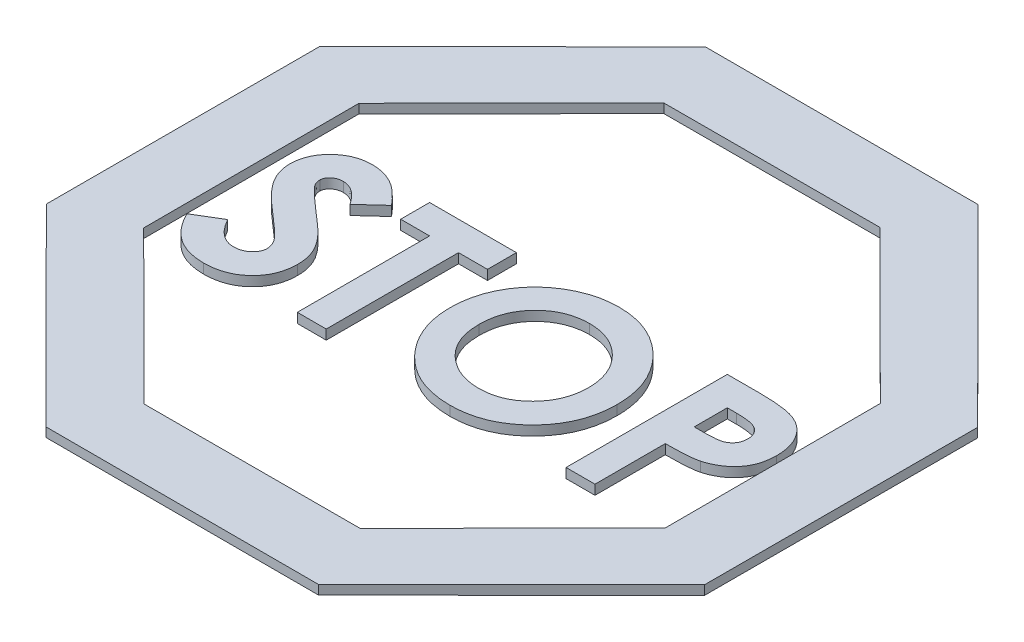
from build123d import *

# Parameters (mm, degrees)
BOSS_EXTRUDE2_DEPTH        = 2
BOSS_EXTRUDE3_DEPTH        = 0.1
BOSS_EXTRUDE3_DEPTH_BACK   = 2
BOSS_EXTRUDE3_2_DEPTH      = 0.1
BOSS_EXTRUDE3_2_DEPTH_BACK = 2
BOSS_EXTRUDE3_3_DEPTH      = 0.1
BOSS_EXTRUDE3_3_DEPTH_BACK = 2
BOSS_EXTRUDE3_4_DEPTH      = 0.1
BOSS_EXTRUDE3_4_DEPTH_BACK = 2


with BuildPart() as part:
    # Sketch1 → Boss-Extrude2 (new body)
    with BuildSketch(Plane(origin=(0, 0, 0), x_dir=(1, 0, 0), z_dir=(0, 1, 0))):
        Polygon((29.558510315, -71.523897401), (71.476055955, -29.674009784), (71.523897401, 29.558510315), (29.674009784, 71.476055955), (-29.558510315, 71.523897401), (-71.476055955, 29.674009784), (-71.523897401, -29.558510315), (-29.674009784, -71.476055955), align=None)
        Polygon((23.480179392, -56.467997014), (56.53189768, -23.325909537), (56.467997014, 23.480179392), (23.325909537, 56.53189768), (-23.480179392, 56.467997014), (-56.53189768, 23.325909537), (-56.467997014, -23.480179392), (-23.325909537, -56.53189768), align=None, mode=Mode.SUBTRACT)
    extrude(amount=BOSS_EXTRUDE2_DEPTH)


with BuildPart() as body_2:
    # Sketch3 → Boss-Extrude3 (new, two sides: drawn at the far end of the back side and taken through both)
    with BuildSketch(Plane(origin=(0, 2, 0), x_dir=(1, 0, 0), z_dir=(0, 1, 0)).offset(-BOSS_EXTRUDE3_DEPTH_BACK)):
        with BuildLine():
            Line((-33.708663209, 7.555768864), (-38.406179234, 3.257892261))
            add(Edge.make_bspline(
                [(-38.406179234, 3.257892261), (-38.607400679, 3.541736027), (-38.99371779, 4.086676474), (-39.619897533, 4.816364578), (-40.243249754, 5.438842832), (-40.869549431, 5.951510812), (-41.504347848, 6.351253677), (-42.146543085, 6.634276042), (-42.79249436, 6.814196045), (-43.226473905, 6.836600414), (-43.440233722, 6.847635851)],
                knots=[0, 0, 0, 0, 1.299362458, 2.494594718, 3.587462134, 4.587049575, 5.512617175, 6.380583204, 7.202344345, 8, 8, 8, 8], degree=3))
            add(Edge.make_bspline(
                [(-43.440233722, 6.847635851), (-43.639622748, 6.840643292), (-44.024590571, 6.827142497), (-44.573390763, 6.692945608), (-45.060623389, 6.461341485), (-45.485812932, 6.15849961), (-45.822625781, 5.79364536), (-46.091544723, 5.411007063), (-46.242968684, 4.98866092), (-46.262899056, 4.698576552), (-46.272765773, 4.554967582)],
                knots=[0, 0, 0, 0, 1.185010067, 2.2879431, 3.333075148, 4.379039566, 5.372662701, 6.27520591, 7.14612461, 8, 8, 8, 8], degree=3))
            add(Edge.make_bspline(
                [(-46.272765773, 4.554967582), (-46.266582802, 4.409287706), (-46.254131157, 4.115908682), (-46.133865218, 3.685925185), (-45.952590109, 3.265781254), (-45.77937434, 3.010019651), (-45.690834683, 2.879286492)],
                knots=[0, 0, 0, 0, 0.967525499, 1.948461899, 2.951351359, 4, 4, 4, 4], degree=3))
            add(Edge.make_bspline(
                [(-45.690834683, 2.879286492), (-45.610342557, 2.777668975), (-45.425060313, 2.543758872), (-45.071765022, 2.17328173), (-44.628100334, 1.719414804), (-44.076993098, 1.197765245), (-43.441321292, 0.589572497), (-42.691620705, -0.081255153), (-41.849470991, -0.835492457), (-41.250890486, -1.360716003), (-40.937228914, -1.635937867)],
                knots=[0, 0, 0, 0, 0.473873513, 1.090794244, 1.870441696, 2.795289791, 3.865433203, 5.087734844, 6.473946851, 8, 8, 8, 8], degree=3))
            add(Edge.make_bspline(
                [(-40.937228914, -1.635937867), (-40.642812409, -1.890740502), (-40.084071051, -2.374302964), (-39.289093053, -3.06064224), (-38.590439795, -3.67812495), (-37.977933494, -4.217484003), (-37.460859147, -4.684378507), (-37.037042972, -5.081040215), (-36.701308774, -5.399746852), (-36.510463539, -5.592245854), (-36.429015773, -5.674399406)],
                knots=[0, 0, 0, 0, 1.543621617, 2.929473131, 4.163658386, 5.240097082, 6.164993805, 6.925417477, 7.541396219, 8, 8, 8, 8], degree=3))
            add(Edge.make_bspline(
                [(-36.429015773, -5.674399406), (-36.120019928, -6.008799087), (-35.5260214, -6.65163271), (-34.754032712, -7.647822659), (-34.11866105, -8.620307177), (-33.627125484, -9.587385136), (-33.255898054, -10.563009548), (-32.994177799, -11.571107548), (-32.837431797, -12.622213129), (-32.820029331, -13.339464372), (-32.811227311, -13.702243957)],
                knots=[0, 0, 0, 0, 1.206664779, 2.319633467, 3.337109185, 4.282041471, 5.190008762, 6.099243693, 7.03861361, 8, 8, 8, 8], degree=3))
            add(Edge.make_bspline(
                [(-32.811227311, -13.702243957), (-32.817492363, -14.055728171), (-32.829784629, -14.749277356), (-32.980341305, -15.764183279), (-33.195026289, -16.735492296), (-33.526966937, -17.652635189), (-33.931534233, -18.530666582), (-34.438717769, -19.355909536), (-35.034335287, -20.136715847), (-35.717004416, -20.859127647), (-36.472117535, -21.514666285), (-37.28204812, -22.098242263), (-38.15471608, -22.580058567), (-39.082665477, -22.976799926), (-40.065399601, -23.282375425), (-41.101747719, -23.508224199), (-42.193294997, -23.643775072), (-42.939710755, -23.657945308), (-43.321043017, -23.665184662)],
                knots=[0, 0, 0, 0, 1.043214005, 2.046824704, 3.02475056, 3.976699089, 4.921714032, 5.875962561, 6.831408892, 7.817874052, 8.806269674, 9.781291748, 10.760897367, 11.74438705, 12.757449933, 13.795994037, 14.874007457, 16, 16, 16, 16], degree=3))
            add(Edge.make_bspline(
                [(-43.321043017, -23.665184662), (-43.620385594, -23.659874125), (-44.213255571, -23.649356217), (-45.087056286, -23.56348625), (-45.930809654, -23.424901259), (-46.743565262, -23.226267569), (-47.528984717, -22.974571743), (-48.287100277, -22.667134933), (-49.012678417, -22.299191985), (-49.711209206, -21.878309267), (-50.379296922, -21.389608992), (-51.025389271, -20.843082476), (-51.643068651, -20.230323897), (-52.235301651, -19.552782406), (-52.798298998, -18.808539367), (-53.350489617, -18.007959742), (-53.867332494, -17.136185861), (-54.18660933, -16.524629431), (-54.34968885, -16.212259983)],
                knots=[0, 0, 0, 0, 1.016823716, 2.013894106, 2.979844003, 3.91962641, 4.853723003, 5.779685073, 6.695824784, 7.614987388, 8.547259901, 9.504950863, 10.487499108, 11.500346958, 12.559593716, 13.656357062, 14.802919212, 16, 16, 16, 16], degree=3))
            Line((-54.34968885, -16.212259983), (-48.824849106, -12.895953893))
            add(Edge.make_bspline(
                [(-48.824849106, -12.895953893), (-48.620861, -13.250534031), (-48.229798366, -13.93029446), (-47.567106174, -14.84363875), (-46.888211854, -15.625766949), (-46.177419979, -16.262854889), (-45.443373511, -16.763421257), (-44.682526836, -17.12116071), (-43.894345397, -17.342601026), (-43.357472008, -17.369644004), (-43.089672824, -17.38313338)],
                knots=[0, 0, 0, 0, 1.283663364, 2.460892379, 3.537111102, 4.529833553, 5.449777664, 6.316464042, 7.160231139, 8, 8, 8, 8], degree=3))
            add(Edge.make_bspline(
                [(-43.089672824, -17.38313338), (-42.817282715, -17.372117224), (-42.288806231, -17.350744276), (-41.534473677, -17.153328805), (-40.84287303, -16.843372033), (-40.245058538, -16.40110646), (-39.738866918, -15.890664771), (-39.365268448, -15.322775052), (-39.130571368, -14.708332084), (-39.105758197, -14.281499581), (-39.093278593, -14.06682729)],
                knots=[0, 0, 0, 0, 1.13588714, 2.203786484, 3.234766741, 4.283437687, 5.291419208, 6.222934724, 7.106237994, 8, 8, 8, 8], degree=3))
            add(Edge.make_bspline(
                [(-39.093278593, -14.06682729), (-39.104802996, -13.867109657), (-39.128213718, -13.461402406), (-39.300649876, -12.858180961), (-39.570220187, -12.255233849), (-39.889140874, -11.760680315), (-40.213682608, -11.346604047), (-40.524017706, -10.987825692), (-40.901923762, -10.59143842), (-41.346442572, -10.156943606), (-41.851700884, -9.680516283), (-42.418124312, -9.162203104), (-43.052199003, -8.606569787), (-43.500364246, -8.228077862), (-43.734704875, -8.030168636)],
                knots=[0, 0, 0, 0, 0.916159276, 1.861089862, 2.860218735, 3.940849679, 4.552606315, 5.27541173, 6.11797699, 7.06649574, 8.129236253, 9.306560635, 10.591630461, 12, 12, 12, 12], degree=3))
            add(Edge.make_bspline(
                [(-43.734704875, -8.030168636), (-44.180195739, -7.653240646), (-45.035227548, -6.929801746), (-46.243495972, -5.861305264), (-47.332254009, -4.862697396), (-48.292097976, -3.921633166), (-49.135257768, -3.05549185), (-49.856023143, -2.257238315), (-50.446476163, -1.520715129), (-51.06780065, -0.648352702), (-51.658183138, 0.414680856), (-52.168441144, 1.693633461), (-52.499475001, 2.972423785), (-52.536562741, 3.830933174), (-52.554817055, 4.25348521)],
                knots=[0, 0, 0, 0, 1.345494975, 2.582412109, 3.71882943, 4.751509156, 5.681369928, 6.505683931, 7.230279997, 7.856715994, 8.973648664, 10.023341002, 11.027102913, 12, 12, 12, 12], degree=3))
            add(Edge.make_bspline(
                [(-52.554817055, 4.25348521), (-52.54722511, 4.553136434), (-52.532268163, 5.143481533), (-52.39884989, 6.011497985), (-52.199451198, 6.849060928), (-51.909867051, 7.65311455), (-51.534021794, 8.422651742), (-51.077572328, 9.161439712), (-50.533430859, 9.862678823), (-49.920220158, 10.525904203), (-49.244618965, 11.132016725), (-48.522653234, 11.666971758), (-47.758409354, 12.118802558), (-46.956562583, 12.493629015), (-46.112144209, 12.780534857), (-45.231375025, 12.983908019), (-44.312991728, 13.10486789), (-43.688327233, 13.12131098), (-43.370121542, 13.129687133)],
                knots=[0, 0, 0, 0, 1.010766082, 1.991317756, 2.957454644, 3.913069143, 4.869106762, 5.843196583, 6.838735724, 7.860187025, 8.887984031, 9.89767229, 10.887916223, 11.879572884, 12.879850636, 13.892031539, 14.926195476, 16, 16, 16, 16], degree=3))
            add(Edge.make_bspline(
                [(-43.370121542, 13.129687133), (-42.957742716, 13.114601437), (-42.136240238, 13.084549126), (-40.92162513, 12.849549875), (-39.735239875, 12.479988799), (-38.779228403, 12.03415402), (-38.01854792, 11.602273658), (-37.435557386, 11.204652624), (-36.842333138, 10.749156359), (-36.23409119, 10.234349474), (-35.622133619, 9.650532331), (-34.989059545, 9.011603156), (-34.343495375, 8.312040108), (-33.923981022, 7.81227551), (-33.708663209, 7.555768864)],
                knots=[0, 0, 0, 0, 1.282922637, 2.555718331, 3.837320111, 5.142675274, 5.830281639, 6.55870424, 7.337177975, 8.157850921, 9.037902056, 9.96903443, 10.957596896, 12, 12, 12, 12], degree=3))
        make_face()
    extrude(amount=BOSS_EXTRUDE3_DEPTH + BOSS_EXTRUDE3_DEPTH_BACK)


with BuildPart() as body_3:
    # Sketch3 → Boss-Extrude3 2 (new, two sides: drawn at the far end of the back side and taken through both)
    with BuildSketch(Plane(origin=(0, 2, 0), x_dir=(1, 0, 0), z_dir=(0, 1, 0)).offset(-BOSS_EXTRUDE3_2_DEPTH_BACK)):
        Polygon((-30.118919619, 12.232251235), (-11.272765773, 12.232251235), (-11.272765773, 5.950199953), (-17.554817055, 5.950199953), (-17.554817055, -22.767748765), (-23.836868337, -22.767748765), (-23.836868337, 5.950199953), (-30.118919619, 5.950199953), align=None)
    extrude(amount=BOSS_EXTRUDE3_2_DEPTH + BOSS_EXTRUDE3_2_DEPTH_BACK)


with BuildPart() as body_4:
    # Sketch3 → Boss-Extrude3 3 (new, two sides: drawn at the far end of the back side and taken through both)
    with BuildSketch(Plane(origin=(0, 2, 0), x_dir=(1, 0, 0), z_dir=(0, 1, 0)).offset(-BOSS_EXTRUDE3_3_DEPTH_BACK)):
        with BuildLine():
            add(Edge.make_bspline(
                [(10.111448971, 13.129687133), (10.719966865, 13.113931515), (11.921319016, 13.082826356), (13.688074507, 12.823540583), (15.390670094, 12.401071588), (17.028335869, 11.813809129), (18.596971305, 11.045847152), (20.102109504, 10.118957885), (21.538359132, 9.015646847), (22.891002656, 7.761652466), (24.141089226, 6.397988331), (25.224289969, 4.929761449), (26.148003824, 3.395015055), (26.913580339, 1.789636749), (27.496709353, 0.102508522), (27.905915101, -1.657767503), (28.168809521, -3.490690542), (28.199046424, -4.738661302), (28.214413714, -5.372917034)],
                knots=[0, 0, 0, 0, 1.014329547, 2.002516266, 2.970391464, 3.935626869, 4.897733899, 5.877609409, 6.878433252, 7.912639331, 8.949961323, 9.958554974, 10.949718813, 11.932905612, 12.9188844, 13.919928257, 14.942845884, 16, 16, 16, 16], degree=3))
            add(Edge.make_bspline(
                [(28.214413714, -5.372917034), (28.198048215, -6.000026169), (28.165799473, -7.235764839), (27.916647602, -9.05179677), (27.500550778, -10.793216571), (26.92731209, -12.463965984), (26.175620239, -14.055952472), (25.269919809, -15.579340647), (24.186311089, -17.019993102), (22.964317544, -18.37713673), (21.619008699, -19.609035782), (20.194113068, -20.694644695), (18.696209937, -21.61454872), (17.12749176, -22.368326496), (15.484594494, -22.953305668), (13.771576298, -23.36605098), (11.988543173, -23.616884641), (10.775994179, -23.648922737), (10.160527496, -23.665184662)],
                knots=[0, 0, 0, 0, 1.051557043, 2.072126891, 3.067553643, 4.050577992, 5.02905126, 6.015227836, 7.017913613, 8.04756643, 9.074058332, 10.072836633, 11.047628519, 12.017157415, 12.98668631, 13.966869689, 14.968021931, 16, 16, 16, 16], degree=3))
            add(Edge.make_bspline(
                [(10.160527496, -23.665184662), (9.516823144, -23.650596914), (8.252032077, -23.621933982), (6.401004689, -23.34936259), (4.627560509, -22.938774855), (2.94659749, -22.325994687), (1.340996459, -21.559967951), (-0.17744576, -20.6165601), (-1.608218873, -19.497330187), (-2.943115729, -18.230942106), (-4.152535513, -16.845235785), (-5.220085701, -15.38135994), (-6.120587967, -13.850497295), (-6.854075257, -12.251931374), (-7.432327172, -10.595596874), (-7.840218197, -8.871406242), (-8.081169159, -7.083494712), (-8.114732229, -5.86910946), (-8.131740132, -5.253726329)],
                knots=[0, 0, 0, 0, 1.067978421, 2.098431617, 3.099715153, 4.085208694, 5.062210972, 6.048429807, 7.046490867, 8.072918869, 9.098532598, 10.095778865, 11.076610158, 12.041847152, 13.011192615, 13.984257998, 14.978533688, 16, 16, 16, 16], degree=3))
            add(Edge.make_bspline(
                [(-8.131740132, -5.253726329), (-8.126402072, -4.839728774), (-8.115793544, -4.016975822), (-7.988002654, -2.797697946), (-7.804020512, -1.602218736), (-7.531919654, -0.435304587), (-7.201386658, 0.711276539), (-6.773134471, 1.82685198), (-6.285667586, 2.923339151), (-5.716108428, 3.987787164), (-5.082813716, 5.010402209), (-4.391832801, 5.986360431), (-3.641428221, 6.903861069), (-2.834017279, 7.76893356), (-1.966817525, 8.575891719), (-1.051236078, 9.336159162), (-0.069515989, 10.029540483), (0.956855971, 10.672969437), (2.022093351, 11.254811081), (3.12185967, 11.750057287), (4.233497568, 12.182547364), (5.371857029, 12.523887655), (6.524738507, 12.801905751), (7.704458204, 12.985763889), (8.900358024, 13.113551241), (9.706793935, 13.124295738), (10.111448971, 13.129687133)],
                knots=[0, 0, 0, 0, 1.034744296, 2.056386356, 3.06226378, 4.057406941, 5.050368692, 6.043467995, 7.042652155, 8.049140477, 9.059438543, 10.048523776, 11.036952808, 12.020949711, 13.004946614, 13.997082645, 14.994316842, 16.007702937, 17.024872941, 18.026463647, 19.021641123, 20.005082605, 20.995858141, 21.984425357, 22.988620895, 24, 24, 24, 24], degree=3))
        make_face()
        with BuildLine():
            add(Edge.make_bspline(
                [(10.013291919, 6.847635851), (9.603759457, 6.836647175), (8.795506256, 6.814959927), (7.609946006, 6.649732429), (6.471766297, 6.385845334), (5.387276511, 6.003608102), (4.351776373, 5.517117117), (3.363430264, 4.928072238), (2.435924733, 4.216225707), (1.55689239, 3.419793389), (0.762831316, 2.532384756), (0.061253306, 1.581375486), (-0.525854486, 0.568353749), (-1.01756094, -0.497269723), (-1.387706922, -1.627477584), (-1.651350808, -2.813416793), (-1.817963902, -4.057130782), (-1.83896569, -4.904968989), (-1.84968885, -5.337860944)],
                knots=[0, 0, 0, 0, 1.033739768, 2.040188636, 3.016340934, 3.979330865, 4.937572243, 5.900995986, 6.878200029, 7.884839167, 8.891893314, 9.879764717, 10.863503415, 11.843163062, 12.837761627, 13.859916423, 14.907309254, 16, 16, 16, 16], degree=3))
            add(Edge.make_bspline(
                [(-1.84968885, -5.337860944), (-1.835471577, -5.817602608), (-1.807608077, -6.757816779), (-1.611557103, -8.129375881), (-1.276133403, -9.424677325), (-0.791788101, -10.637385987), (-0.191072858, -11.780968086), (0.554920135, -12.8414074), (1.434109323, -13.825053344), (2.11142955, -14.399346817), (2.455198971, -14.690825688)],
                knots=[0, 0, 0, 0, 1.078454662, 2.113592447, 3.107694534, 4.079536787, 5.043276885, 6.005368276, 6.987637804, 8, 8, 8, 8], degree=3))
            add(Edge.make_bspline(
                [(2.455198971, -14.690825688), (2.736811756, -14.906159082), (3.293692543, -15.331974373), (4.18259552, -15.877744023), (5.097990555, -16.345523056), (6.046785448, -16.723482981), (7.026976395, -17.020779905), (8.038428981, -17.228972052), (9.079710064, -17.359630629), (9.783873131, -17.375246804), (10.139493842, -17.38313338)],
                knots=[0, 0, 0, 0, 1.023928204, 2.024787132, 3.009472467, 3.9914905, 4.972207045, 5.96565515, 6.972602802, 8, 8, 8, 8], degree=3))
            add(Edge.make_bspline(
                [(10.139493842, -17.38313338), (10.541984384, -17.372051533), (11.333897184, -17.35024765), (12.49738759, -17.187054193), (13.612046737, -16.910871943), (14.684794523, -16.53198783), (15.712537624, -16.03938853), (16.690253177, -15.432073328), (17.619655386, -14.71749927), (18.497567853, -13.910608052), (19.300021347, -13.019703642), (20.000135308, -12.063621787), (20.605910195, -11.063427831), (21.087391606, -10.004965545), (21.47216122, -8.898226319), (21.732632013, -7.738308641), (21.900652611, -6.529994134), (21.921660315, -5.707693411), (21.932362432, -5.288782418)],
                knots=[0, 0, 0, 0, 1.026359118, 2.019393844, 2.989460624, 3.950973911, 4.916101784, 5.890408035, 6.881132271, 7.902007068, 8.92769091, 9.933912415, 10.920395702, 11.90457117, 12.894218921, 13.903490204, 14.931958862, 16, 16, 16, 16], degree=3))
            add(Edge.make_bspline(
                [(21.932362432, -5.288782418), (21.921290021, -4.87228028), (21.899495667, -4.052459339), (21.73601498, -2.847251401), (21.461584206, -1.692454419), (21.081562344, -0.586182491), (20.596294551, 0.472648942), (19.996211695, 1.480316403), (19.283419394, 2.435845723), (18.474322517, 3.332725336), (17.593670295, 4.15690025), (16.64820214, 4.872134255), (15.664373314, 5.493649865), (14.619609982, 5.980520098), (13.535287128, 6.368408579), (12.404788156, 6.654055223), (11.223831232, 6.813799196), (10.420401819, 6.836256429), (10.013291919, 6.847635851)],
                knots=[0, 0, 0, 0, 1.055025985, 2.07665775, 3.074803781, 4.057872707, 5.035505728, 6.020516407, 7.023567878, 8.050795229, 9.077271434, 10.074415901, 11.050397877, 12.019801805, 12.988065821, 13.964604439, 14.968634123, 16, 16, 16, 16], degree=3))
        make_face(mode=Mode.SUBTRACT)
    extrude(amount=BOSS_EXTRUDE3_3_DEPTH + BOSS_EXTRUDE3_3_DEPTH_BACK)


with BuildPart() as body_5:
    # Sketch3 → Boss-Extrude3 4 (new, two sides: drawn at the far end of the back side and taken through both)
    with BuildSketch(Plane(origin=(0, 2, 0), x_dir=(1, 0, 0), z_dir=(0, 1, 0)).offset(-BOSS_EXTRUDE3_4_DEPTH_BACK)):
        with BuildLine():
            Line((34.496464996, 12.232251235), (41.507682945, 12.232251235))
            add(Edge.make_bspline(
                [(41.507682945, 12.232251235), (41.96578683, 12.230200665), (42.849565249, 12.226244685), (44.124046441, 12.178273161), (45.299817743, 12.092305269), (46.376609023, 11.98606255), (47.35397753, 11.837114391), (48.233147225, 11.666356989), (49.014300555, 11.458324776), (49.706246186, 11.211393422), (50.327245039, 10.920271003), (50.914910244, 10.610204847), (51.455960503, 10.240151825), (51.977704258, 9.849994681), (52.450312517, 9.402461852), (52.903269414, 8.927337298), (53.317390988, 8.40577797), (53.694596125, 7.844097203), (54.036779307, 7.252672455), (54.335733427, 6.630446435), (54.578228267, 5.976434536), (54.781651284, 5.29486747), (54.945042634, 4.585774942), (55.053801118, 3.84479597), (55.127675351, 3.07710435), (55.134193732, 2.554612949), (55.137490637, 2.290344184)],
                knots=[0, 0, 0, 0, 1.698747864, 3.27724071, 4.728299578, 6.070144658, 7.288476769, 8.393259625, 9.389771311, 10.283485332, 11.113357557, 11.931608583, 12.74405601, 13.541433047, 14.344816069, 15.154114104, 15.974336324, 16.810834471, 17.661136416, 18.50621059, 19.367396281, 20.244825668, 21.142564693, 22.063065223, 23.020325768, 24, 24, 24, 24], degree=3))
            add(Edge.make_bspline(
                [(55.137490637, 2.290344184), (55.132720429, 1.997989941), (55.123346382, 1.423477928), (55.031450519, 0.581313802), (54.874463351, -0.221613445), (54.669289333, -0.99207504), (54.383188756, -1.717395183), (54.056332283, -2.414880235), (53.654195144, -3.064974856), (53.194689176, -3.675810947), (52.692856236, -4.252354894), (52.136782831, -4.77796008), (51.537067962, -5.256209538), (50.89718316, -5.692115359), (50.214726108, -6.084798225), (49.490189232, -6.437935193), (48.718624982, -6.740231848), (48.181330852, -6.89833055), (47.908924932, -6.978485944)],
                knots=[0, 0, 0, 0, 1.102006807, 2.165578795, 3.188629044, 4.184801286, 5.166646146, 6.124351954, 7.085497154, 8.042432466, 9.003981491, 9.963833307, 10.922997304, 11.89326795, 12.880200226, 13.889073926, 14.929769137, 16, 16, 16, 16], degree=3))
            add(Edge.make_bspline(
                [(47.908924932, -6.978485944), (47.729502723, -7.02312648), (47.340816441, -7.119832256), (46.697647402, -7.218012891), (45.956462614, -7.308283949), (45.114865343, -7.385860994), (44.172370386, -7.438595309), (43.129890326, -7.479778463), (41.986952727, -7.509722869), (41.192199117, -7.510785428), (40.778516278, -7.511338508)],
                knots=[0, 0, 0, 0, 0.618981996, 1.340914327, 2.176866532, 3.120127938, 4.170906482, 5.338178032, 6.614476169, 8, 8, 8, 8], degree=3))
            Line((40.778516278, -7.511338508), (40.778516278, -22.767748765))
            Line((40.778516278, -22.767748765), (34.496464996, -22.767748765))
            Line((34.496464996, -22.767748765), (34.496464996, 12.232251235))
        make_face()
        with BuildLine():
            Line((40.778516278, -1.229287226), (43.001072368, -1.229287226))
            add(Edge.make_bspline(
                [(43.001072368, -1.229287226), (43.405501538, -1.226722831), (44.149657218, -1.222004307), (45.165911092, -1.153771698), (45.982592253, -1.049566723), (46.627785536, -0.900112689), (47.137226744, -0.673296402), (47.576587891, -0.410912671), (47.953439163, -0.079135646), (48.279736898, 0.299976375), (48.540602104, 0.735595087), (48.721498537, 1.220627288), (48.839005303, 1.744881929), (48.849858144, 2.10972846), (48.855439355, 2.297355402)],
                knots=[0, 0, 0, 0, 1.8619151, 3.425951444, 4.686033666, 5.651700536, 6.461346321, 7.243864085, 7.999046032, 8.762387399, 9.539336099, 10.322741239, 11.137448474, 12, 12, 12, 12], degree=3))
            add(Edge.make_bspline(
                [(48.855439355, 2.297355402), (48.849915555, 2.461282618), (48.839198054, 2.77934083), (48.760464373, 3.238377721), (48.634985535, 3.666294798), (48.453171522, 4.058623034), (48.218129055, 4.414695802), (47.931564722, 4.73437283), (47.597155708, 5.024500274), (47.338972397, 5.178069162), (47.207803137, 5.256089376)],
                knots=[0, 0, 0, 0, 1.102301479, 2.1387299, 3.123554645, 4.094223062, 5.036071848, 5.982632524, 6.975082478, 8, 8, 8, 8], degree=3))
            add(Edge.make_bspline(
                [(47.207803137, 5.256089376), (47.096695203, 5.312279845), (46.861456936, 5.431246582), (46.460823361, 5.569554112), (45.998498334, 5.68623175), (45.471360638, 5.783073062), (44.88151318, 5.858231978), (44.229061195, 5.915709747), (43.513044541, 5.938823796), (43.015097801, 5.94630331), (42.75567974, 5.950199953)],
                knots=[0, 0, 0, 0, 0.656809284, 1.390599849, 2.23162475, 3.173112763, 4.218524733, 5.370385145, 6.63003504, 8, 8, 8, 8], degree=3))
            Line((42.75567974, 5.950199953), (40.778516278, 5.950199953))
            Line((40.778516278, 5.950199953), (40.778516278, -1.229287226))
        make_face(mode=Mode.SUBTRACT)
    extrude(amount=BOSS_EXTRUDE3_4_DEPTH + BOSS_EXTRUDE3_4_DEPTH_BACK)


solid = Compound([part.part, body_2.part, body_3.part, body_4.part, body_5.part])
